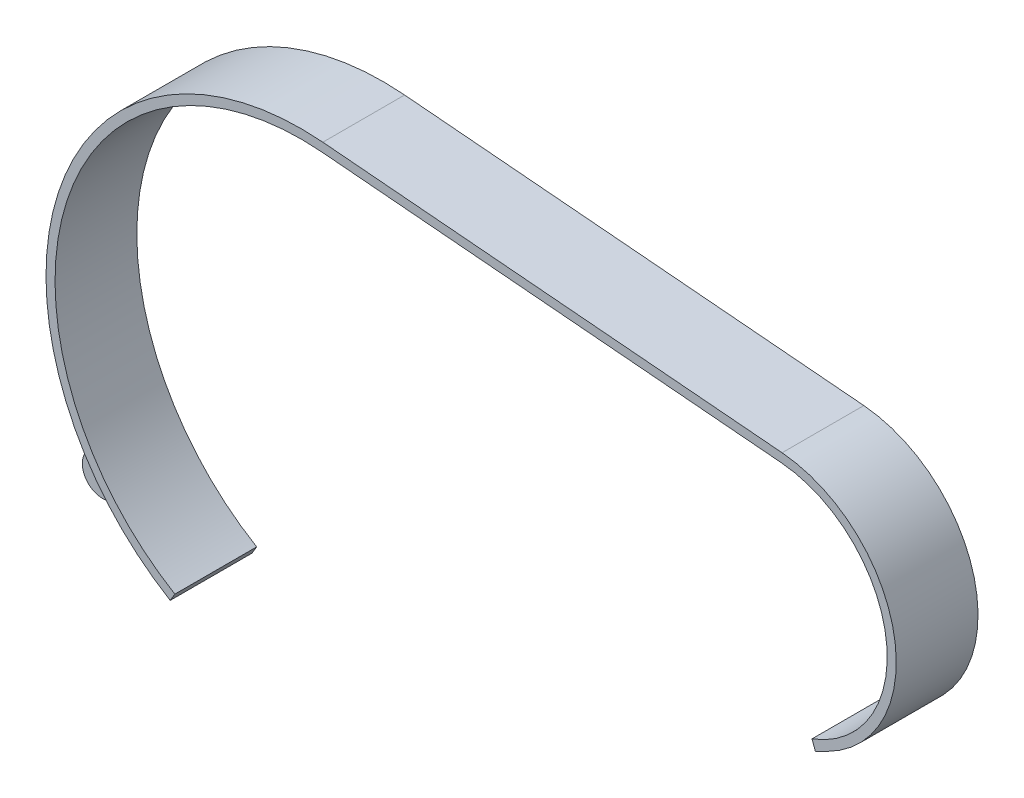
from build123d import *

# Parameters (mm, degrees)
BOSS_EXTRUDE1_DEPTH = 25.4
SKETCH2_R           = 7.0739
SKETCH2_R_2         = 3.2639
BOSS_EXTRUDE2_DEPTH = 3.175
BOSS_EXTRUDE3_DEPTH = 3.302


with BuildPart() as part:
    # Sketch1 → Boss-Extrude1 (new body)
    with BuildSketch(Plane.XY):
        with BuildLine():
            ThreePointArc((70.001721328, 21.116929737), (32.109818913, 121.760822938), (121.667937999, 181.295122405))
            Line((121.667937999, 181.295122405), (282.867264941, 167.491822308))
            ThreePointArc((282.867264941, 167.491822308), (319.66332332, 132.52036188), (293.637822612, 88.935659637))
            Line((293.637822612, 88.935659637), (294.839214659, 85.723778364))
            Line((294.839214659, 85.723778364), (299.063190222, 87.84501085))
            ThreePointArc((299.063190222, 87.84501085), (322.426612475, 135.274348553), (283.138145015, 170.655245926))
            Line((283.138145015, 170.655245926), (121.938818073, 184.458546023))
            ThreePointArc((121.938818073, 184.458546023), (29.088121079, 122.735485546), (68.373108141, 18.391449213))
            Line((68.373108141, 18.391449213), (70.001721328, 21.116929737))
        make_face()
    extrude(amount=BOSS_EXTRUDE1_DEPTH)

    # Sketch2 → Boss-Extrude2 (add)
    # profile 1 of 2: a face of its own
    with BuildSketch(Plane(origin=(0, 0, 0), x_dir=(-1, 0, 0), z_dir=(0, 0, -1))):
        with BuildLine():
            ThreePointArc((-36.587701927, 50.782990283), (-44.384911147, 39.317928918), (-53.858754358, 29.194174745))
            Line((-53.858754358, 29.194174745), (-22.316186857, 12.775282108))
            ThreePointArc((-22.316186857, 12.775282108), (-23.932636358, 13.931413925), (-25.163710326, 15.491544259))
            ThreePointArc((-25.163710326, 15.491544259), (-23.930769686, 24.17036605), (-15.202863294, 24.986295173))
            ThreePointArc((-15.202863294, 24.986295173), (-14.373460165, 24.357545231), (-13.645291854, 23.613900861))
            Line((-13.645291854, 23.613900861), (-36.587701927, 50.782990283))
        make_face()
    # profile 2 of 2: a face of its own
    with BuildSketch(Plane(origin=(0, 0, 0), x_dir=(-1, 0, 0), z_dir=(0, 0, -1))):
        with Locations((-19.05, 19.05)):
            Circle(SKETCH2_R)
        with Locations((-19.05, 19.05)):
            Circle(SKETCH2_R_2, mode=Mode.SUBTRACT)
    extrude(amount=-BOSS_EXTRUDE2_DEPTH)

    # Sketch3 → Boss-Extrude3 (add)
    with BuildSketch(Plane.XY.offset(25.4)):
        with BuildLine():
            Line((68.373108141, 18.391449213), (70.001721328, 21.116929737))
            ThreePointArc((70.001721328, 21.116929737), (32.109818913, 121.760822938), (121.667937999, 181.295122405))
            Line((121.667937999, 181.295122405), (282.867264941, 167.491822308))
            ThreePointArc((282.867264941, 167.491822308), (319.66332332, 132.52036188), (293.637822612, 88.935659637))
            Line((293.637822612, 88.935659637), (294.839214659, 85.723778364))
            Line((294.839214659, 85.723778364), (299.063190222, 87.84501085))
            ThreePointArc((299.063190222, 87.84501085), (322.426612475, 135.274348553), (283.138145015, 170.655245926))
            Line((283.138145015, 170.655245926), (121.938818073, 184.458546023))
            ThreePointArc((121.938818073, 184.458546023), (29.088121079, 122.735485546), (68.373108141, 18.391449213))
        make_face()
    extrude(amount=BOSS_EXTRUDE3_DEPTH)


solid = part.part
